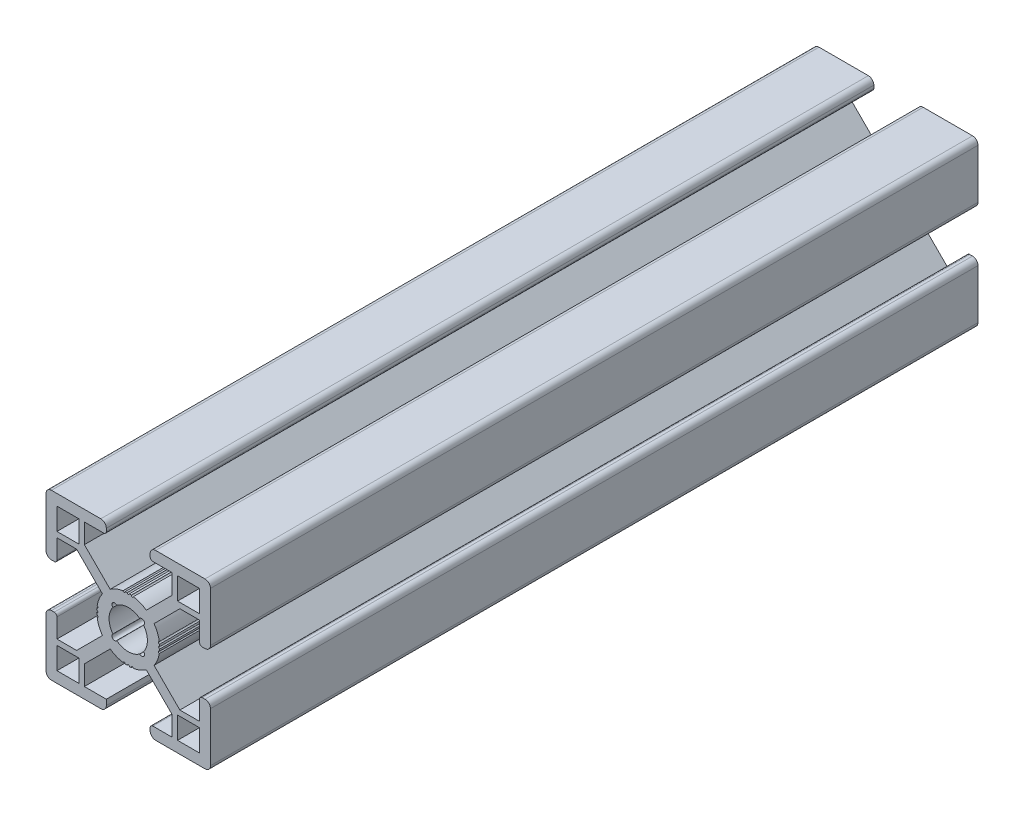
from build123d import *

# Parameters (mm, degrees)
SKETCH1_W           = 4
SKETCH1_H           = 4
BOSS_EXTRUDE1_DEPTH = 70


with BuildPart() as part:
    # Sketch1 → Boss-Extrude1 (new, symmetric)
    with BuildSketch(Plane.XY):
        with BuildLine():
            Line((-15, 14), (-15, 5))
            ThreePointArc((-15, 5), (-14.707106781, 4.292893219), (-14, 4))
            Line((-14, 4), (-13.5, 4))
            ThreePointArc((-13.5, 4), (-13.146446609, 4.146446609), (-13, 4.5))
            Line((-13, 4.5), (-13, 8))
            Line((-13, 8), (-9.414213562, 8))
            Line((-9.414213562, 8), (-4.711011126, 3.296797563))
            ThreePointArc((-4.711011126, 3.296797563), (-5.322383956, 2.17594325), (-5.671345569, 0.947807702))
            ThreePointArc((-5.671345569, 0.947807702), (-5.502585747, 0.723913043), (-5.723511591, 0.551284925))
            ThreePointArc((-5.723511591, 0.551284925), (-5.737706139, 0.375803491), (-5.746521739, 0.199969752))
            ThreePointArc((-5.746521739, 0.199969752), (-5.607354194, 0.140186212), (-5.55, 0))
            ThreePointArc((-5.55, 0), (-5.607354194, -0.140186212), (-5.746521739, -0.199969752))
            ThreePointArc((-5.746521739, -0.199969752), (-5.737706139, -0.375803491), (-5.723511591, -0.551284925))
            ThreePointArc((-5.723511591, -0.551284925), (-5.502585747, -0.723913043), (-5.671345569, -0.947807702))
            ThreePointArc((-5.671345569, -0.947807702), (-5.322383956, -2.17594325), (-4.711011126, -3.296797563))
            Line((-4.711011126, -3.296797563), (-9.414213562, -8))
            Line((-9.414213562, -8), (-13, -8))
            Line((-13, -8), (-13, -4.5))
            ThreePointArc((-13, -4.5), (-13.146446609, -4.146446609), (-13.5, -4))
            Line((-13.5, -4), (-14, -4))
            ThreePointArc((-14, -4), (-14.707106781, -4.292893219), (-15, -5))
            Line((-15, -5), (-15, -14))
            ThreePointArc((-15, -14), (-14.707106781, -14.707106781), (-14, -15))
            Line((-14, -15), (-5, -15))
            ThreePointArc((-5, -15), (-4.292893219, -14.707106781), (-4, -14))
            Line((-4, -14), (-4, -13))
            Line((-4, -13), (-8, -13))
            Line((-8, -13), (-8, -9.414213562))
            Line((-8, -9.414213562), (-3.296797563, -4.711011126))
            ThreePointArc((-3.296797563, -4.711011126), (-2.17594325, -5.322383956), (-0.947807702, -5.671345569))
            ThreePointArc((-0.947807702, -5.671345569), (-0.723913043, -5.502585747), (-0.551284925, -5.723511591))
            ThreePointArc((-0.551284925, -5.723511591), (-0.375803491, -5.737706139), (-0.199969752, -5.746521739))
            ThreePointArc((-0.199969752, -5.746521739), (-0.140186212, -5.607354194), (0, -5.55))
            ThreePointArc((0, -5.55), (0.140186212, -5.607354194), (0.199969752, -5.746521739))
            ThreePointArc((0.199969752, -5.746521739), (0.375803491, -5.737706139), (0.551284925, -5.723511591))
            ThreePointArc((0.551284925, -5.723511591), (0.723913043, -5.502585747), (0.947807702, -5.671345569))
            ThreePointArc((0.947807702, -5.671345569), (2.17594325, -5.322383956), (3.296797563, -4.711011126))
            Line((3.296797563, -4.711011126), (8, -9.414213562))
            Line((8, -9.414213562), (8, -13))
            Line((8, -13), (4.5, -13))
            ThreePointArc((4.5, -13), (4.146446609, -13.146446609), (4, -13.5))
            Line((4, -13.5), (4, -14))
            ThreePointArc((4, -14), (4.292893219, -14.707106781), (5, -15))
            Line((5, -15), (14, -15))
            ThreePointArc((14, -15), (14.707106781, -14.707106781), (15, -14))
            Line((15, -14), (15, -5))
            ThreePointArc((15, -5), (14.707106781, -4.292893219), (14, -4))
            Line((14, -4), (13.5, -4))
            ThreePointArc((13.5, -4), (13.146446609, -4.146446609), (13, -4.5))
            Line((13, -4.5), (13, -8))
            Line((13, -8), (9.414213562, -8))
            Line((9.414213562, -8), (4.711011126, -3.296797563))
            ThreePointArc((4.711011126, -3.296797563), (5.322383956, -2.17594325), (5.671345569, -0.947807702))
            ThreePointArc((5.671345569, -0.947807702), (5.502585747, -0.723913043), (5.723511591, -0.551284925))
            ThreePointArc((5.723511591, -0.551284925), (5.737706139, -0.375803491), (5.746521739, -0.199969752))
            ThreePointArc((5.746521739, -0.199969752), (5.607354194, -0.140186212), (5.55, 0))
            ThreePointArc((5.55, 0), (5.607354194, 0.140186212), (5.746521739, 0.199969752))
            ThreePointArc((5.746521739, 0.199969752), (5.737706139, 0.375803491), (5.723511591, 0.551284925))
            ThreePointArc((5.723511591, 0.551284925), (5.502585747, 0.723913043), (5.671345569, 0.947807702))
            ThreePointArc((5.671345569, 0.947807702), (5.322383956, 2.17594325), (4.711011126, 3.296797563))
            Line((4.711011126, 3.296797563), (9.414213562, 8))
            Line((9.414213562, 8), (13, 8))
            Line((13, 8), (13, 4.5))
            ThreePointArc((13, 4.5), (13.146446609, 4.146446609), (13.5, 4))
            Line((13.5, 4), (14, 4))
            ThreePointArc((14, 4), (14.707106781, 4.292893219), (15, 5))
            Line((15, 5), (15, 14))
            ThreePointArc((15, 14), (14.707106781, 14.707106781), (14, 15))
            Line((14, 15), (5, 15))
            ThreePointArc((5, 15), (4.292893219, 14.707106781), (4, 14))
            Line((4, 14), (4, 13.5))
            ThreePointArc((4, 13.5), (4.146446609, 13.146446609), (4.5, 13))
            Line((4.5, 13), (8, 13))
            Line((8, 13), (8, 9.414213562))
            Line((8, 9.414213562), (3.296797563, 4.711011126))
            ThreePointArc((3.296797563, 4.711011126), (2.17594325, 5.322383956), (0.947807702, 5.671345569))
            ThreePointArc((0.947807702, 5.671345569), (0.723913043, 5.502585747), (0.551284925, 5.723511591))
            ThreePointArc((0.551284925, 5.723511591), (0.375803491, 5.737706139), (0.199969752, 5.746521739))
            ThreePointArc((0.199969752, 5.746521739), (0.140186212, 5.607354194), (0, 5.55))
            ThreePointArc((0, 5.55), (-0.140186212, 5.607354194), (-0.199969752, 5.746521739))
            ThreePointArc((-0.199969752, 5.746521739), (-0.375803491, 5.737706139), (-0.551284925, 5.723511591))
            ThreePointArc((-0.551284925, 5.723511591), (-0.723913043, 5.502585747), (-0.947807702, 5.671345569))
            ThreePointArc((-0.947807702, 5.671345569), (-2.17594325, 5.322383956), (-3.296797563, 4.711011126))
            Line((-3.296797563, 4.711011126), (-8, 9.414213562))
            Line((-8, 9.414213562), (-8, 13))
            Line((-8, 13), (-4.5, 13))
            ThreePointArc((-4.5, 13), (-4.146446609, 13.146446609), (-4, 13.5))
            Line((-4, 13.5), (-4, 14))
            ThreePointArc((-4, 14), (-4.292893219, 14.707106781), (-5, 15))
            Line((-5, 15), (-14, 15))
            ThreePointArc((-14, 15), (-14.707106781, 14.707106781), (-15, 14))
        make_face()
        with Locations((-11, -11)):
            Rectangle(SKETCH1_W, SKETCH1_H, mode=Mode.SUBTRACT)
        with Locations((11, -11)):
            Rectangle(SKETCH1_W, SKETCH1_H, mode=Mode.SUBTRACT)
        with BuildLine():
            ThreePointArc((-2.096969605, 2.802270236), (-1.105000944, 3.320989749), (0, 3.5))
            ThreePointArc((0, 3.5), (1.105000944, 3.320989749), (2.096969605, 2.802270236))
            ThreePointArc((2.096969605, 2.802270236), (2.828427125, 2.828427125), (2.802270236, 2.096969605))
            ThreePointArc((2.802270236, 2.096969605), (3.320989749, 1.105000944), (3.5, 0))
            ThreePointArc((3.5, 0), (3.320989749, -1.105000944), (2.802270236, -2.096969605))
            ThreePointArc((2.802270236, -2.096969605), (2.828427125, -2.828427125), (2.096969605, -2.802270236))
            ThreePointArc((2.096969605, -2.802270236), (1.105000944, -3.320989749), (0, -3.5))
            ThreePointArc((0, -3.5), (-1.105000944, -3.320989749), (-2.096969605, -2.802270236))
            ThreePointArc((-2.096969605, -2.802270236), (-2.828427125, -2.828427125), (-2.802270236, -2.096969605))
            ThreePointArc((-2.802270236, -2.096969605), (-3.320989749, -1.105000944), (-3.5, 0))
            ThreePointArc((-3.5, 0), (-3.320989749, 1.105000944), (-2.802270236, 2.096969605))
            ThreePointArc((-2.802270236, 2.096969605), (-2.828427125, 2.828427125), (-2.096969605, 2.802270236))
        make_face(mode=Mode.SUBTRACT)
        with Locations((-11, 11)):
            Rectangle(SKETCH1_W, SKETCH1_H, mode=Mode.SUBTRACT)
        with Locations((11, 11)):
            Rectangle(SKETCH1_W, SKETCH1_H, mode=Mode.SUBTRACT)
    extrude(amount=BOSS_EXTRUDE1_DEPTH, both=True)


solid = part.part
